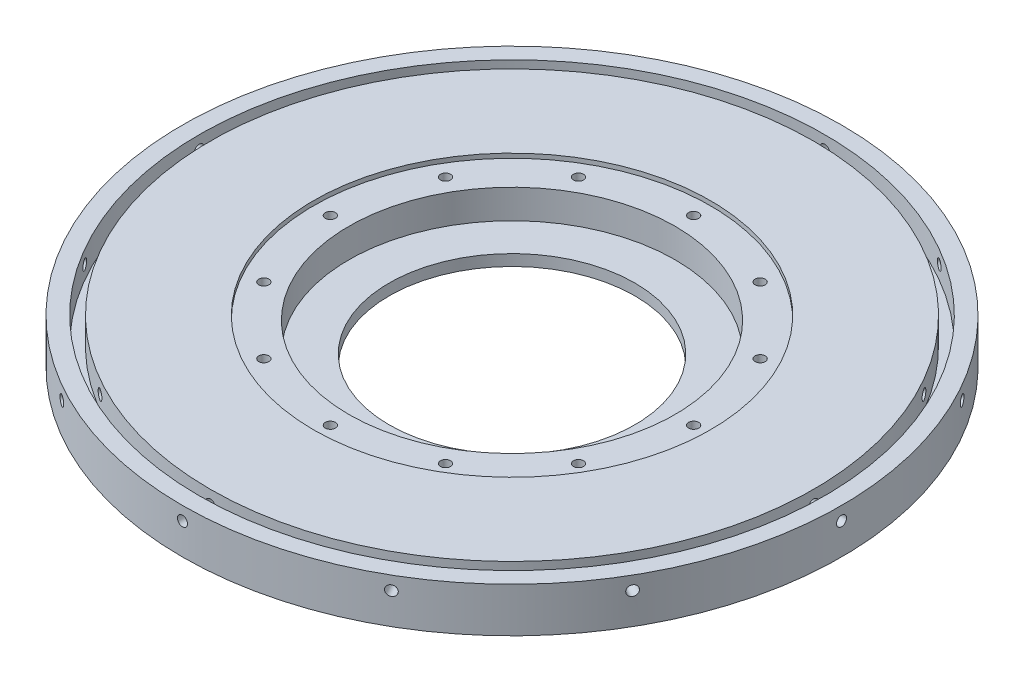
from build123d import *

# Parameters (mm, degrees)
SKETCH1_W           = 127.635
SKETCH1_H           = 127.635
BOSS_EXTRUDE1_DEPTH = 9.525
SKETCH13_R          = 93.6625
BOSS_EXTRUDE2_DEPTH = 12.7
SKETCH5_R           = 46.355
CUT_EXTRUDE1_DEPTH  = 9.525
SKETCH11_R          = 1.4351
CUT_EXTRUDE3_DEPTH  = 224.072165005
CIRPATTERN1_COUNT   = 12
SKETCH12_R          = 56.41975
CUT_EXTRUDE4_DEPTH  = 1.27
SKETCH16_R          = 88.9
SKETCH16_R_2        = 85.725
CUT_EXTRUDE5_DEPTH  = 7.62
SKETCH17_R          = 1.4351
CUT_EXTRUDE6_DEPTH  = 15.24
CIRPATTERN2_COUNT   = 12
SKETCH19_R          = 34.925
CUT_EXTRUDE7_DEPTH  = 87.63


with BuildPart() as part:
    # Sketch1 → Boss-Extrude1 (new body)
    with BuildSketch(Plane(origin=(0, 0, 0), x_dir=(1, 0, 0), z_dir=(0, 1, 0))):
        with Locations((63.8175, 63.8175)):
            Rectangle(SKETCH1_W, SKETCH1_H)
    extrude(amount=BOSS_EXTRUDE1_DEPTH)

    # Sketch13 → Boss-Extrude2 (add)
    with BuildSketch(Plane(origin=(0, 9.525, 0), x_dir=(1, 0, 0), z_dir=(0, 1, 0))):
        with Locations(Location((63.8175, 63.8175, 0), (0, 0, 270))):
            Circle(SKETCH13_R)
    extrude(amount=-BOSS_EXTRUDE2_DEPTH)

    # Sketch5 → Cut-Extrude1 (cut)
    with BuildSketch(Plane(origin=(0, 9.525, 0), x_dir=(1, 0, 0), z_dir=(0, 1, 0))):
        with Locations(Location((63.8175, 63.8175, 0), (0, 0, 270))):
            Circle(SKETCH5_R)
    extrude(amount=-CUT_EXTRUDE1_DEPTH, mode=Mode.SUBTRACT)

    # Sketch11 → Cut-Extrude3 (cut, through all)
    with BuildSketch(Plane(origin=(0, 9.525, 0), x_dir=(1, 0, 0), z_dir=(0, 1, 0))):
        with Locations(Location((63.8175, 115.443, 0), (0, 0, 270))):
            Circle(SKETCH11_R)
    cut_extrude3 = extrude(amount=-CUT_EXTRUDE3_DEPTH, mode=Mode.SUBTRACT)

    # CirPattern1: Cut-Extrude3 ×12 about axis
    cirpattern1_axis = Axis((63.8175, 0, -63.8175), (0, 1, 0))
    for i in range(1, CIRPATTERN1_COUNT):
        add(cut_extrude3.rotate(cirpattern1_axis, i * 360 / CIRPATTERN1_COUNT), mode=Mode.SUBTRACT)

    # Sketch12 → Cut-Extrude4 (cut)
    with BuildSketch(Plane(origin=(0, 9.525, 0), x_dir=(1, 0, 0), z_dir=(0, 1, 0))):
        with Locations(Location((63.8175, 63.8175, 0), (0, 0, 270))):
            Circle(SKETCH12_R)
    extrude(amount=-CUT_EXTRUDE4_DEPTH, mode=Mode.SUBTRACT)

    # Sketch16 → Cut-Extrude5 (cut)
    with BuildSketch(Plane(origin=(0, 9.525, 0), x_dir=(1, 0, 0), z_dir=(0, 1, 0))):
        with Locations(Location((63.8175, 63.8175, 0), (0, 0, 270))):
            Circle(SKETCH16_R)
        with Locations(Location((63.8175, 63.8175, 0), (0, 0, 270))):
            Circle(SKETCH16_R_2, mode=Mode.SUBTRACT)
    extrude(amount=-CUT_EXTRUDE5_DEPTH, mode=Mode.SUBTRACT)

    # Sketch17 → Cut-Extrude6 (cut)
    with BuildSketch(Plane.XY.offset(29.845)):
        with Locations((63.8175, 5.715)):
            Circle(SKETCH17_R)
    cut_extrude6 = extrude(amount=-CUT_EXTRUDE6_DEPTH, mode=Mode.SUBTRACT)

    # CirPattern2: Cut-Extrude6 ×12 about axis
    cirpattern2_axis = Axis((63.8175, 0, -63.8175), (0, 1, 0))
    for i in range(1, CIRPATTERN2_COUNT):
        add(cut_extrude6.rotate(cirpattern2_axis, i * 360 / CIRPATTERN2_COUNT), mode=Mode.SUBTRACT)

    # Sketch19 → Cut-Extrude7 (cut)
    with BuildSketch(Plane.XZ.offset(3.175)):
        with Locations(Location((63.8175, -63.8175, 0), (0, 0, 270))):
            Circle(SKETCH19_R)
    extrude(amount=-CUT_EXTRUDE7_DEPTH, mode=Mode.SUBTRACT)


solid = part.part
